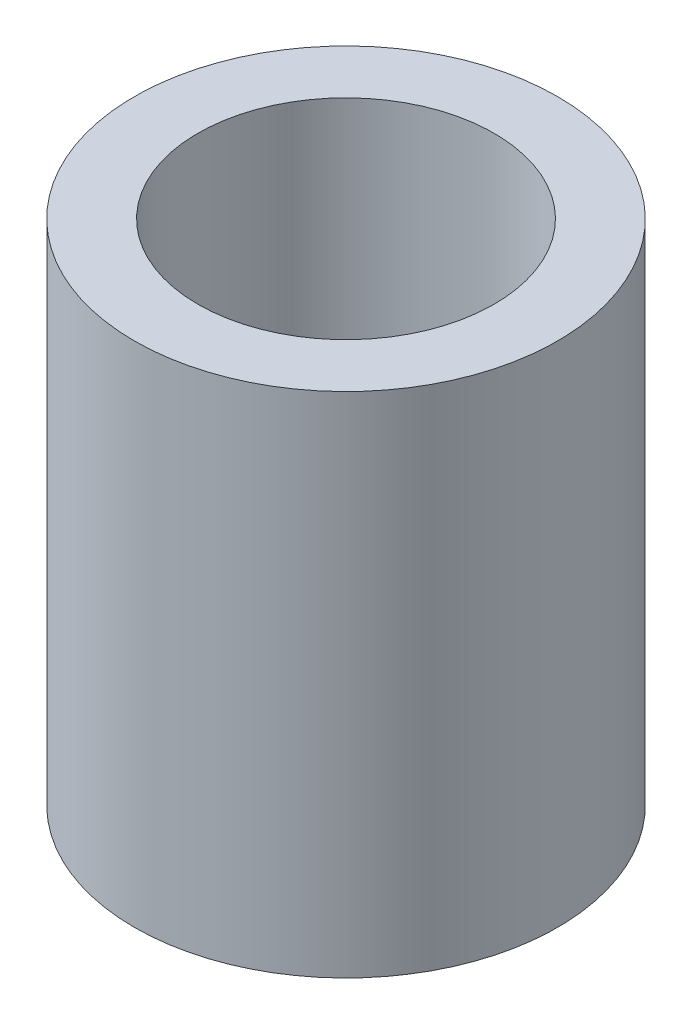
from build123d import *

# Parameters (mm, degrees)
SKETCH1_R           = 2.8575
SKETCH1_R_2         = 2
BOSS_EXTRUDE1_DEPTH = 6.858


with BuildPart() as part:
    # Sketch1 → Boss-Extrude1 (new body)
    with BuildSketch(Plane(origin=(0, 0, 0), x_dir=(1, 0, 0), z_dir=(0, 1, 0))):
        with Locations(Location((0, 0, 0), (0, 0, 270))):
            Circle(SKETCH1_R)
        with Locations(Location((0, 0, 0), (0, 0, 270))):
            Circle(SKETCH1_R_2, mode=Mode.SUBTRACT)
    extrude(amount=-BOSS_EXTRUDE1_DEPTH)


solid = part.part
